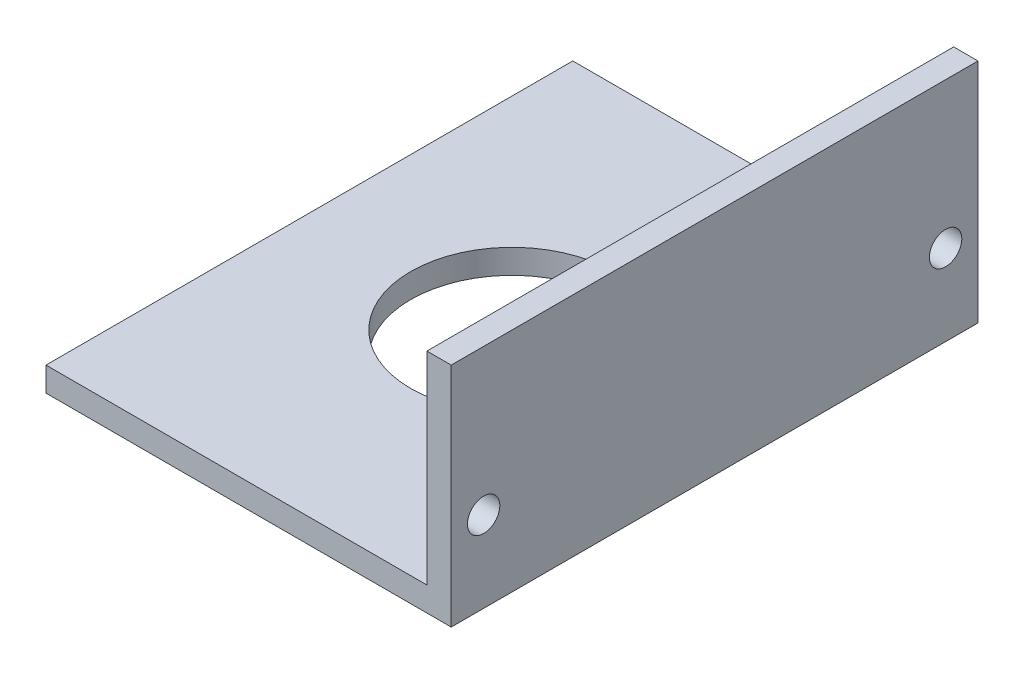
from build123d import *

# Parameters (mm, degrees)
SKETCH1_W           = 50
SKETCH1_H           = 65
BOSS_EXTRUDE1_DEPTH = 3
SKETCH2_W           = 3
SKETCH2_H           = 65
BOSS_EXTRUDE2_DEPTH = 25
SKETCH4_R           = 12.499228858
CUT_EXTRUDE1_DEPTH  = 3
SKETCH5_R           = 2
CUT_EXTRUDE2_DEPTH  = 30


with BuildPart() as part:
    # Sketch1 → Boss-Extrude1 (new body)
    with BuildSketch(Plane(origin=(0, 0, 0), x_dir=(1, 0, 0), z_dir=(0, 1, 0))):
        Rectangle(SKETCH1_W, SKETCH1_H)
    extrude(amount=BOSS_EXTRUDE1_DEPTH)

    # Sketch2 → Boss-Extrude2 (add)
    with BuildSketch(Plane(origin=(0, 3, 0), x_dir=(1, 0, 0), z_dir=(0, 1, 0))):
        with Locations((23.5, 0)):
            Rectangle(SKETCH2_W, SKETCH2_H)
    extrude(amount=BOSS_EXTRUDE2_DEPTH)

    # Sketch4 → Cut-Extrude1 (cut)
    with BuildSketch(Plane.XZ):
        with Locations(Location((0, 0, 0), (0, 0, 270))):
            Circle(SKETCH4_R)
    extrude(amount=-CUT_EXTRUDE1_DEPTH, mode=Mode.SUBTRACT)

    # Sketch5 → Cut-Extrude2 (cut)
    with BuildSketch(Plane.ZY.offset(-22)):
        with Locations((28.5, 10)):
            Circle(SKETCH5_R)
        with Locations((-28.5, 10)):
            Circle(SKETCH5_R)
    extrude(amount=-CUT_EXTRUDE2_DEPTH, mode=Mode.SUBTRACT)


solid = part.part
